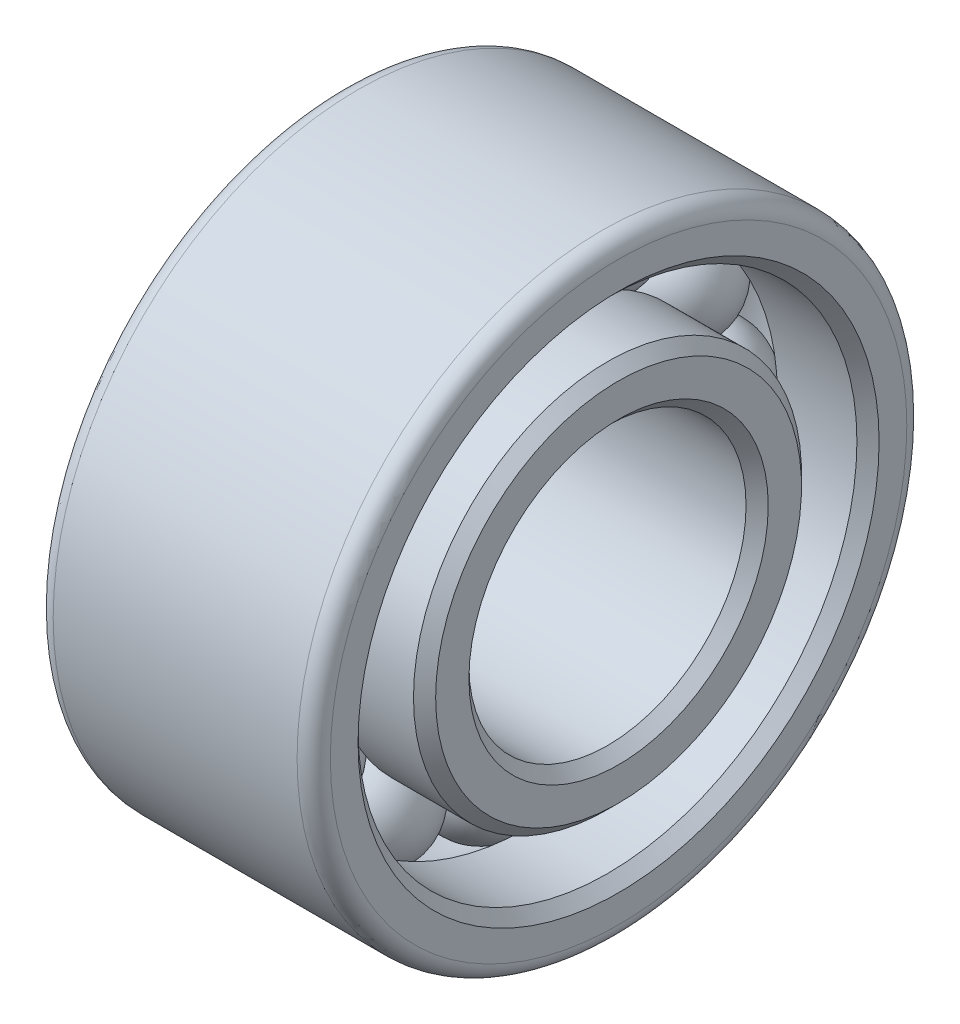
from build123d import *

# Parameters (mm, degrees)
PATTERN_CIRCULAR_5_COUNT = 12
FILLET_1_R               = 0.3
CHAMFER_1_SIZE           = 0.2
CHAMFER_2_SIZE           = 0.2
CHAMFER_3_SIZE           = 0.2


with BuildPart() as part:
    # Эскиз1 → Повернуть1 (revolve)
    with BuildSketch(Plane.XY, mode=Mode.PRIVATE) as revolve_1_sk:
        with BuildLine():
            Line((0, 0), (5, 0))
            Line((5, 0), (5, 1))
            Line((5, 1), (3.366025404, 1))
            ThreePointArc((3.366025404, 1), (2.5, 0.5), (1.633974596, 1))
            Line((1.633974596, 1), (0, 1))
            Line((0, 1), (0, 0))
        make_face()
        with BuildLine():
            Line((0, 2), (1.633974596, 2))
            ThreePointArc((1.633974596, 2), (2.5, 2.5), (3.366025404, 2))
            Line((3.366025404, 2), (5, 2))
            Line((5, 2), (5, 3))
            Line((5, 3), (0, 3))
            Line((0, 3), (0, 2))
        make_face()
    revolve(revolve_1_sk.sketch.rotate(Axis((-1.066901408, -2.5, 0), (1, 0, 0)), 90), axis=Axis((-1.066901408, -2.5, 0), (1, 0, 0)))

    # Скругление1
    fillet_1_edges = [part.edges().sort_by_distance(p)[0] for p in [
        (0, -2.5, -5.5),
        (5, -2.5, -5.5),
    ]]
    fillet(fillet_1_edges, radius=FILLET_1_R)

    # Фаска1
    chamfer_1_edges = [part.edges().sort_by_distance(p)[0] for p in [
        (5, -2.5, -2.5),
        (0, -2.5, -2.5),
    ]]
    chamfer(chamfer_1_edges, length=CHAMFER_1_SIZE)

    # Фаска2
    chamfer_2_edges = [part.edges().sort_by_distance(p)[0] for p in [
        (0, -2.5, -3.5),
        (5, -2.5, -3.5),
    ]]
    chamfer(chamfer_2_edges, length=CHAMFER_2_SIZE)

    # Фаска3
    chamfer_3_edges = [part.edges().sort_by_distance(p)[0] for p in [
        (5, -2.5, -4.5),
        (0, -2.5, -4.5),
    ]]
    chamfer(chamfer_3_edges, length=CHAMFER_3_SIZE)


with BuildPart() as body_2:
    # Эскиз2 → Повернуть2 (revolve)
    with BuildSketch(Plane.XY):
        with BuildLine():
            Line((2.5, 2.5), (2.5, 0.5))
            ThreePointArc((2.5, 0.5), (1.5, 1.5), (2.5, 2.5))
        make_face()
    revolve(axis=Axis((2.5, 2.5, 0), (0, -1, 0)))


with BuildPart() as pattern_circular_5_1:
    # Круговой массив5: pattern copy
    add(body_2.part.rotate(Axis((0, -2.5, 0), (1, 0, 0)), 1 * 360 / PATTERN_CIRCULAR_5_COUNT))


with BuildPart() as pattern_circular_5_2:
    # Круговой массив5: pattern copy
    add(body_2.part.rotate(Axis((0, -2.5, 0), (1, 0, 0)), 2 * 360 / PATTERN_CIRCULAR_5_COUNT))


with BuildPart() as pattern_circular_5_3:
    # Круговой массив5: pattern copy
    add(body_2.part.rotate(Axis((0, -2.5, 0), (1, 0, 0)), 3 * 360 / PATTERN_CIRCULAR_5_COUNT))


with BuildPart() as pattern_circular_5_4:
    # Круговой массив5: pattern copy
    add(body_2.part.rotate(Axis((0, -2.5, 0), (1, 0, 0)), 4 * 360 / PATTERN_CIRCULAR_5_COUNT))


with BuildPart() as pattern_circular_5_5:
    # Круговой массив5: pattern copy
    add(body_2.part.rotate(Axis((0, -2.5, 0), (1, 0, 0)), 5 * 360 / PATTERN_CIRCULAR_5_COUNT))


with BuildPart() as pattern_circular_5_6:
    # Круговой массив5: pattern copy
    add(body_2.part.rotate(Axis((0, -2.5, 0), (1, 0, 0)), 6 * 360 / PATTERN_CIRCULAR_5_COUNT))


with BuildPart() as pattern_circular_5_7:
    # Круговой массив5: pattern copy
    add(body_2.part.rotate(Axis((0, -2.5, 0), (1, 0, 0)), 7 * 360 / PATTERN_CIRCULAR_5_COUNT))


with BuildPart() as pattern_circular_5_8:
    # Круговой массив5: pattern copy
    add(body_2.part.rotate(Axis((0, -2.5, 0), (1, 0, 0)), 8 * 360 / PATTERN_CIRCULAR_5_COUNT))


with BuildPart() as pattern_circular_5_9:
    # Круговой массив5: pattern copy
    add(body_2.part.rotate(Axis((0, -2.5, 0), (1, 0, 0)), 9 * 360 / PATTERN_CIRCULAR_5_COUNT))


with BuildPart() as pattern_circular_5_10:
    # Круговой массив5: pattern copy
    add(body_2.part.rotate(Axis((0, -2.5, 0), (1, 0, 0)), 10 * 360 / PATTERN_CIRCULAR_5_COUNT))


with BuildPart() as pattern_circular_5_11:
    # Круговой массив5: pattern copy
    add(body_2.part.rotate(Axis((0, -2.5, 0), (1, 0, 0)), 11 * 360 / PATTERN_CIRCULAR_5_COUNT))


solid = Compound([part.part, body_2.part, pattern_circular_5_1.part, pattern_circular_5_2.part, pattern_circular_5_3.part, pattern_circular_5_4.part, pattern_circular_5_5.part, pattern_circular_5_6.part, pattern_circular_5_7.part, pattern_circular_5_8.part, pattern_circular_5_9.part, pattern_circular_5_10.part, pattern_circular_5_11.part])
